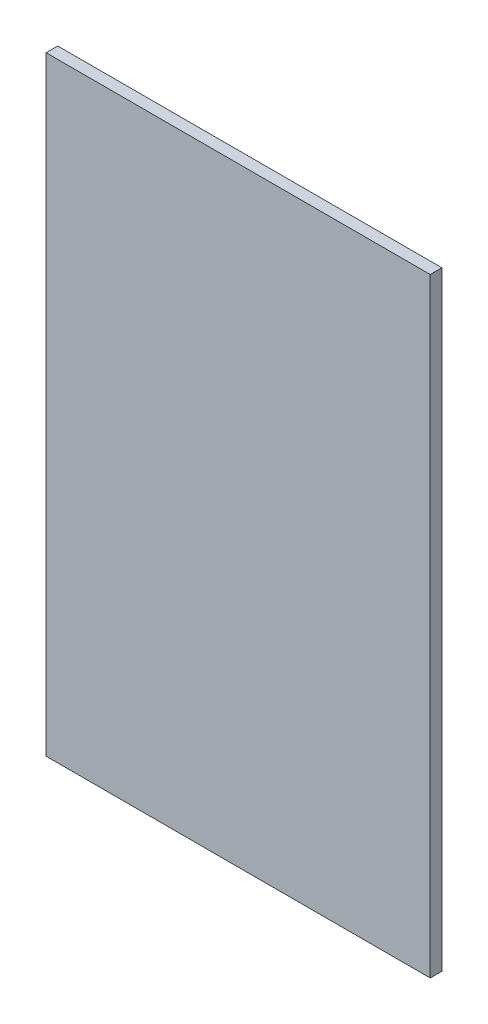
from build123d import *

# Parameters (mm, degrees)
ESQUISSE1_W        = 725
ESQUISSE1_H        = 1150
BOSS_EXTRU_1_DEPTH = 22


with BuildPart() as part:
    # Esquisse1 → Boss.-Extru.1 (new body)
    with BuildSketch(Plane.XY):
        with Locations((362.5, 575)):
            Rectangle(ESQUISSE1_W, ESQUISSE1_H)
    extrude(amount=BOSS_EXTRU_1_DEPTH)


solid = part.part
